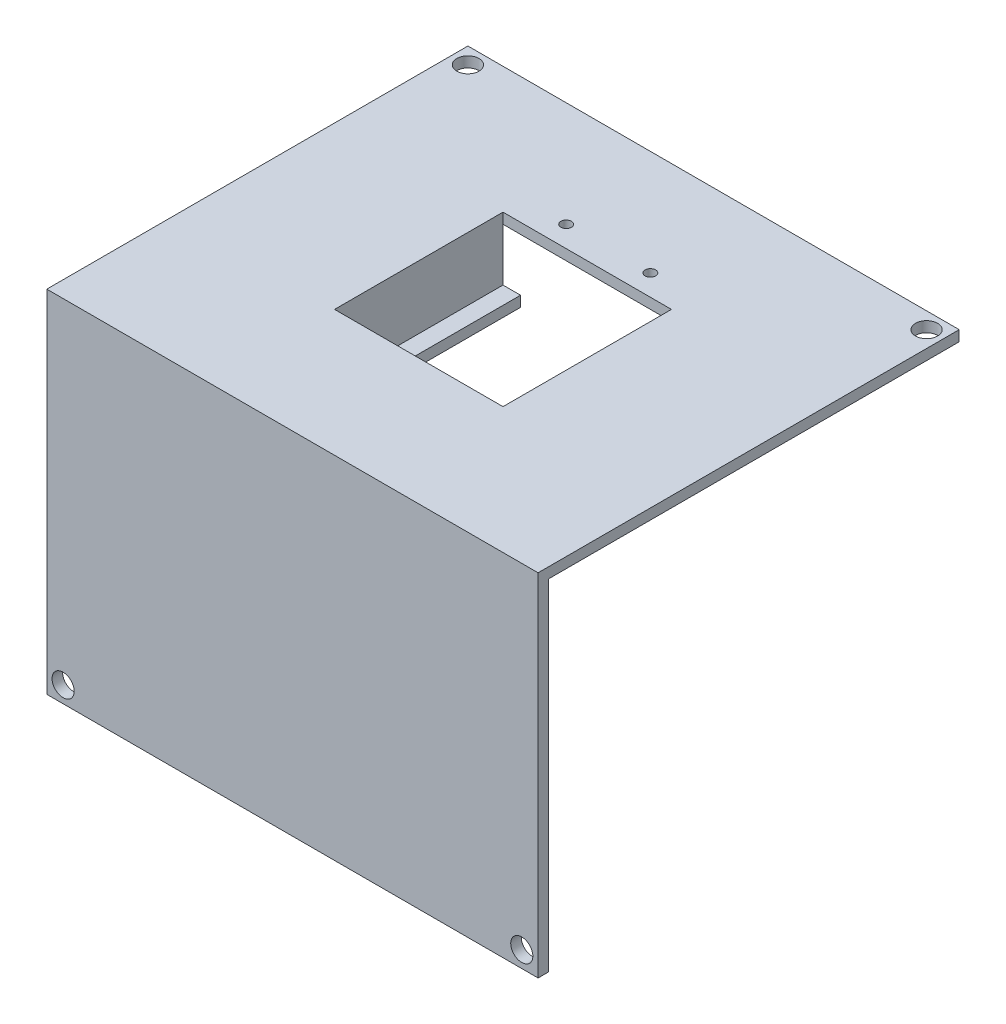
from build123d import *

# Parameters (mm, degrees)
SKETCH1_W                 = 140
SKETCH1_H                 = 120
BOSS_EXTRUDE1_DEPTH       = 100
SHELL1_T                  = -3
SKETCH6_R                 = 3.15
CUT_EXTRUDE4_DEPTH        = 3
SKETCH7_R                 = 3.15
CUT_EXTRUDE5_DEPTH        = 3
SKETCH8_W                 = 48
SKETCH8_H                 = 48
CUT_EXTRUDE6_DEPTH        = 3
SKETCH9_W                 = 5
SKETCH9_H                 = 48
BOSS_EXTRUDE2_DEPTH       = 15
SKETCH10_W                = 10
SKETCH10_H                = 48
BOSS_EXTRUDE3_DEPTH       = 3
F_3_0MM_DOWEL_HOLE1_D     = 3
F_3_0MM_DOWEL_HOLE1_DEPTH = 5
F_3_0MM_DOWEL_HOLE1_TIP   = 0.901290929


with BuildPart() as part:
    # Sketch1 → Boss-Extrude1 (new body)
    with BuildSketch(Plane(origin=(0, 0, 0), x_dir=(1, 0, 0), z_dir=(0, 1, 0))):
        Rectangle(SKETCH1_W, SKETCH1_H)
    extrude(amount=BOSS_EXTRUDE1_DEPTH)

    # Shell1
    shell1_openings = [part.faces().sort_by_distance(p)[0] for p in [
        (0, 0, 0),
        (-70, 50, 0),
        (0, 50, -60),
        (70, 50, 0),
    ]]
    offset(amount=SHELL1_T, openings=shell1_openings, kind=Kind.INTERSECTION)

    # Sketch6 → Cut-Extrude4 (cut)
    with BuildSketch(Plane.XY.offset(60)):
        with Locations((-65.35, 4.65)):
            Circle(SKETCH6_R)
        with Locations((65.35, 4.65)):
            Circle(SKETCH6_R)
    extrude(amount=-CUT_EXTRUDE4_DEPTH, mode=Mode.SUBTRACT)

    # Sketch7 → Cut-Extrude5 (cut)
    with BuildSketch(Plane(origin=(0, 100, 0), x_dir=(1, 0, 0), z_dir=(0, 1, 0))):
        with Locations(Location((-65.35, 55.35, 0), (0, 0, 270))):
            Circle(SKETCH7_R)
        with Locations(Location((65.35, 55.35, 0), (0, 0, 270))):
            Circle(SKETCH7_R)
    extrude(amount=-CUT_EXTRUDE5_DEPTH, mode=Mode.SUBTRACT)

    # Sketch8 → Cut-Extrude6 (cut)
    with BuildSketch(Plane.XZ.offset(-97)):
        Rectangle(SKETCH8_W, SKETCH8_H)
    extrude(amount=-CUT_EXTRUDE6_DEPTH, mode=Mode.SUBTRACT)

    # Sketch9 → Boss-Extrude2 (add)
    with BuildSketch(Plane.XZ.offset(-97)):
        with Locations((26.5, 0)):
            Rectangle(SKETCH9_W, SKETCH9_H)
        with Locations((-26.5, 0)):
            Rectangle(SKETCH9_W, SKETCH9_H)
    extrude(amount=BOSS_EXTRUDE2_DEPTH)

    # Sketch10 → Boss-Extrude3 (add)
    with BuildSketch(Plane.XZ.offset(-82)):
        with Locations((24, 0)):
            Rectangle(SKETCH10_W, SKETCH10_H)
        with Locations((-24, 0)):
            Rectangle(SKETCH10_W, SKETCH10_H)
    extrude(amount=BOSS_EXTRUDE3_DEPTH)

    # Ø3.0mm Dowel Hole1
    with Locations(Plane(origin=(0, 97, 0), x_dir=(-1, 0, 0), z_dir=(0, -1, 0))):
        with Locations((12, 30), (-12, 30)):
            Hole(F_3_0MM_DOWEL_HOLE1_D / 2, depth=F_3_0MM_DOWEL_HOLE1_DEPTH)
            with Locations((0, 0, -(F_3_0MM_DOWEL_HOLE1_DEPTH + F_3_0MM_DOWEL_HOLE1_TIP / 2))):  # 118° drill point
                Cone(0, F_3_0MM_DOWEL_HOLE1_D / 2, F_3_0MM_DOWEL_HOLE1_TIP, mode=Mode.SUBTRACT)


solid = part.part
